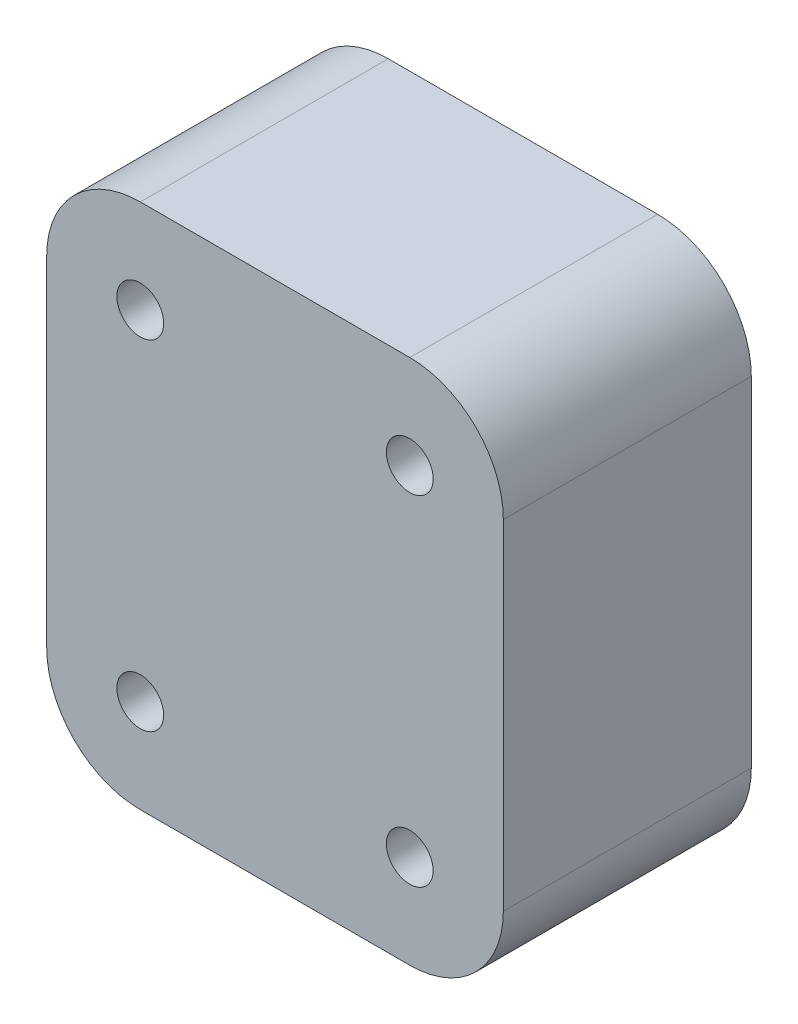
from build123d import *

# Parameters (mm, degrees)
SKETCH1_W           = 48.8
SKETCH1_H           = 56.25
SKETCH1_R           = 2.5
BOSS_EXTRUDE1_DEPTH = 26.5
FILLET1_R           = 10


with BuildPart() as part:
    # Sketch1 → Boss-Extrude1 (new body)
    with BuildSketch(Plane.XY):
        with Locations((-15.79375, 0)):
            Rectangle(SKETCH1_W, SKETCH1_H)
        with Locations((-1.39375, -18.125)):
            Circle(SKETCH1_R, mode=Mode.SUBTRACT)
        with Locations((-30.19375, -18.125)):
            Circle(SKETCH1_R, mode=Mode.SUBTRACT)
        with Locations((-1.39375, 18.125)):
            Circle(SKETCH1_R, mode=Mode.SUBTRACT)
        with Locations((-30.19375, 18.125)):
            Circle(SKETCH1_R, mode=Mode.SUBTRACT)
    extrude(amount=BOSS_EXTRUDE1_DEPTH)

    # Fillet1
    fillet1_edges = [part.edges().sort_by_distance(p)[0] for p in [
        (8.60625, 28.125, 13.25),
        (8.60625, -28.125, 13.25),
        (-40.19375, -28.125, 13.25),
        (-40.19375, 28.125, 13.25),
    ]]
    fillet(fillet1_edges, radius=FILLET1_R)


solid = part.part
